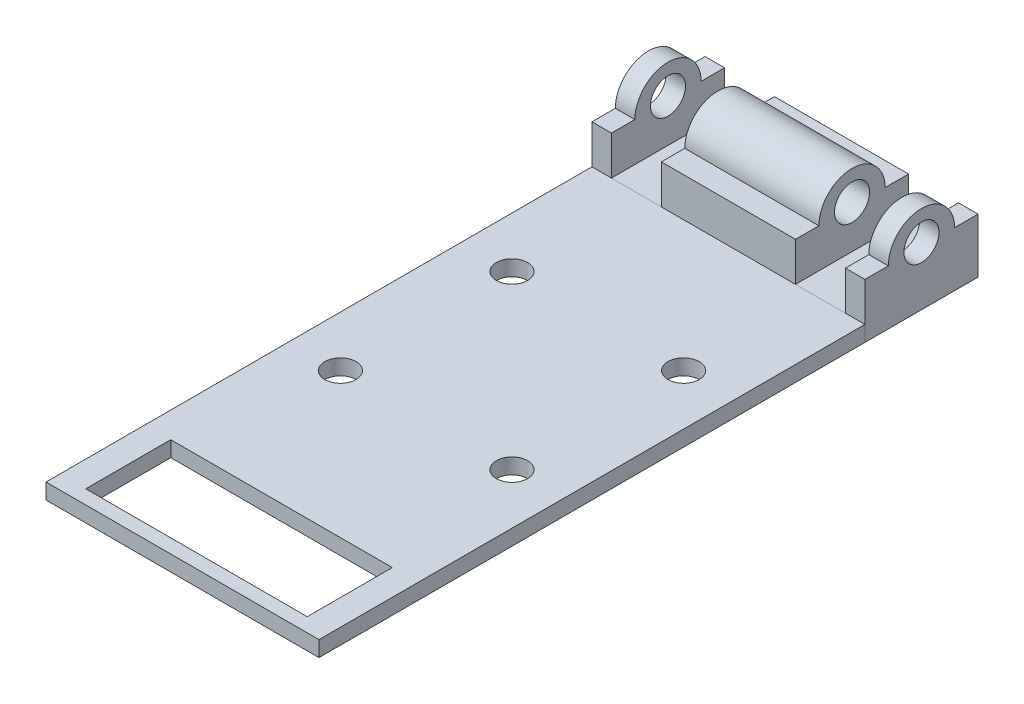
from build123d import *

# Parameters (mm, degrees)
SKETCH1_R                = 2.25
BOSS_EXTRUDE1_DEPTH      = 20
SKETCH2_W                = 30
SKETCH2_H                = 9.25
CUT_EXTRUDE1_DEPTH       = 28.799505391
SKETCH3_W                = 2.5
SKETCH3_H                = 14.25
CUT_EXTRUDE2_DEPTH       = 28.799505391
BOSS_EXTRUDE2_DEPTH      = 8.6
BOSS_EXTRUDE2_DEPTH_BACK = 8.6
SKETCH5_R                = 2.25
SKETCH6_W                = 4.5
SKETCH6_H                = 3
CUT_EXTRUDE4_DEPTH       = 38.948978906
SKETCH9_W                = 35
SKETCH9_H                = 70
BOSS_EXTRUDE4_DEPTH      = 2
SKETCH10_W               = 28.4
SKETCH10_H               = 10.9
CUT_EXTRUDE5_DEPTH       = 80.745689539
SKETCH13_R               = 2
CUT_EXTRUDE6_DEPTH       = 80.745689539


with BuildPart() as part:
    # Sketch1 → Boss-Extrude1 (new, symmetric)
    with BuildSketch(Plane(origin=(0, 0, 0), x_dir=(0, 0, -1), z_dir=(1, 0, 0))):
        with BuildLine():
            Line((2.25, 1.5), (7.25, 1.5))
            Line((7.25, 1.5), (7.25, 8.5))
            Line((7.25, 8.5), (4.25, 8.5))
            ThreePointArc((4.25, 8.5), (0, 12.75), (-4.25, 8.5))
            Line((-4.25, 8.5), (-7.25, 8.5))
            Line((-7.25, 8.5), (-7.25, 1.5))
            Line((-7.25, 1.5), (-2.25, 1.5))
            Line((-2.25, 1.5), (-2.25, -1.5))
            Line((-2.25, -1.5), (2.25, -1.5))
            Line((2.25, -1.5), (2.25, 1.5))
        make_face()
        with Locations((0, 9)):
            Circle(SKETCH1_R, mode=Mode.SUBTRACT)
    extrude(amount=BOSS_EXTRUDE1_DEPTH, both=True)

    # Sketch2 → Cut-Extrude1 (cut, through all)
    with BuildSketch(Plane.XY.offset(7.25)):
        with Locations((0, 8.125)):
            Rectangle(SKETCH2_W, SKETCH2_H)
    extrude(amount=-CUT_EXTRUDE1_DEPTH, mode=Mode.SUBTRACT)

    # Sketch3 → Cut-Extrude2 (cut, through all)
    with BuildSketch(Plane.XY.offset(7.25)):
        with Locations((-18.75, 5.625)):
            Rectangle(SKETCH3_W, SKETCH3_H)
        with Locations((18.75, 5.625)):
            Rectangle(SKETCH3_W, SKETCH3_H)
    extrude(amount=-CUT_EXTRUDE2_DEPTH, mode=Mode.SUBTRACT)

    # Sketch5 → Boss-Extrude2 (add, two sides: drawn at the far end of the back side and taken through both)
    with BuildSketch(Plane(origin=(0, 0, 0), x_dir=(0, 0, -1), z_dir=(1, 0, 0)).offset(-BOSS_EXTRUDE2_DEPTH_BACK)):
        with BuildLine():
            Line((-4.25, 8.5), (-7.25, 8.5))
            Line((-7.25, 8.5), (-7.25, 3.5))
            Line((-7.25, 3.5), (7.25, 3.5))
            Line((7.25, 3.5), (7.25, 8.5))
            Line((7.25, 8.5), (4.25, 8.5))
            ThreePointArc((4.25, 8.5), (0, 12.75), (-4.25, 8.5))
        make_face()
        with Locations(Location((0, 9, 0), (0, 0, 270))):
            Circle(SKETCH5_R, mode=Mode.SUBTRACT)
    extrude(amount=BOSS_EXTRUDE2_DEPTH + BOSS_EXTRUDE2_DEPTH_BACK)

    # Sketch6 → Cut-Extrude4 (cut, through all)
    with BuildSketch(Plane.ZY.offset(17.5)):
        Rectangle(SKETCH6_W, SKETCH6_H)
    extrude(amount=-CUT_EXTRUDE4_DEPTH, mode=Mode.SUBTRACT)


with BuildPart() as body_2:
    # Sketch9 → Boss-Extrude4 (new body)
    with BuildSketch(Plane.XZ.offset(-1.5)):
        with Locations((0, 42.25)):
            Rectangle(SKETCH9_W, SKETCH9_H)
    extrude(amount=-BOSS_EXTRUDE4_DEPTH)

    # Sketch10 → Cut-Extrude5 (cut, through all)
    with BuildSketch(Plane(origin=(0, 3.5, 0), x_dir=(1, 0, 0), z_dir=(0, 1, 0))):
        with Locations((0, -70)):
            Rectangle(SKETCH10_W, SKETCH10_H)
    extrude(amount=-CUT_EXTRUDE5_DEPTH, mode=Mode.SUBTRACT)

    # Sketch13 → Cut-Extrude6 (cut, through all)
    with BuildSketch(Plane(origin=(0, 3.5, 0), x_dir=(1, 0, 0), z_dir=(0, 1, 0))):
        with Locations(Location((-11, -46, 0), (0, 0, 270))):
            Circle(SKETCH13_R)
        with Locations(Location((11, -46, 0), (0, 0, 270))):
            Circle(SKETCH13_R)
        with Locations(Location((11, -24, 0), (0, 0, 270))):
            Circle(SKETCH13_R)
        with Locations(Location((-11, -24, 0), (0, 0, 270))):
            Circle(SKETCH13_R)
    extrude(amount=-CUT_EXTRUDE6_DEPTH, mode=Mode.SUBTRACT)


solid = Compound([part.part, body_2.part])
